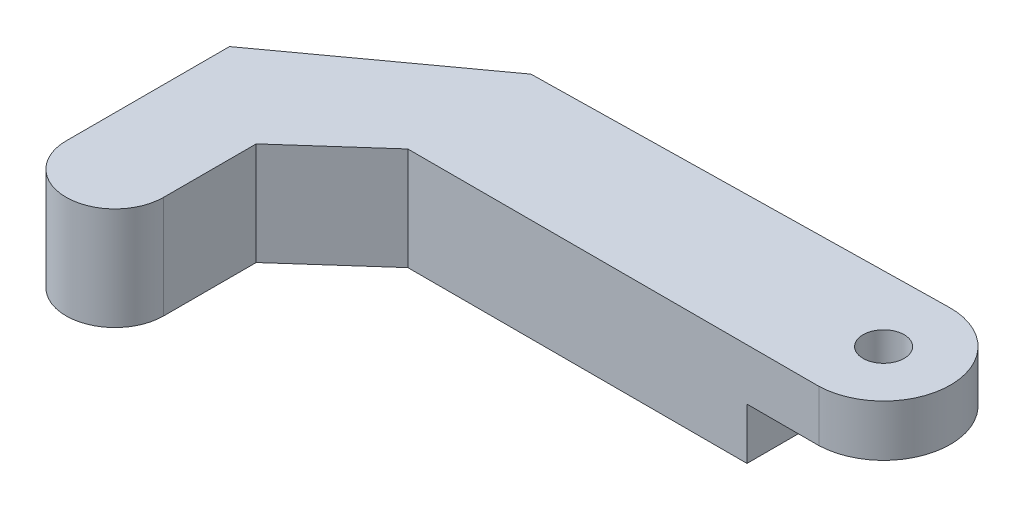
from build123d import *

# Parameters (mm, degrees)
CROQUIS1_R              = 2
SALIENTE_EXTRUIR1_DEPTH = 10
CROQUIS3_R              = 2
CORTAR_EXTRUIR1_DEPTH   = 5


with BuildPart() as part:
    # Croquis1 → Saliente-Extruir1 (new body)
    with BuildSketch(Plane(origin=(0, 0, 0), x_dir=(1, 0, 0), z_dir=(0, 1, 0))):
        with BuildLine():
            Line((0.204691251, -6.496776238), (-39.795308749, -6.496776238))
            Line((-39.795308749, -6.496776238), (-47.602797524, -13.442682877))
            Line((-47.602797524, -13.442682877), (-47.602797524, -22.442682877))
            ThreePointArc((-47.602797524, -22.442682877), (-52.352797524, -27.192682877), (-57.102797524, -22.442682877))
            Line((-57.102797524, -22.442682877), (-57.102797524, -6.542682877))
            Line((-57.102797524, -6.542682877), (-40.113440642, 5.800807421))
            Line((-40.113440642, 5.800807421), (-0.113440642, 6.499010019))
            ThreePointArc((-0.113440642, 6.499010019), (6.498053307, 0.159069868), (0.204691251, -6.496776238))
        make_face()
        with Locations(Location((0, 0, 0), (0, 0, 270))):
            Circle(CROQUIS1_R, mode=Mode.SUBTRACT)
    extrude(amount=SALIENTE_EXTRUIR1_DEPTH)

    # Croquis3 → Cortar-Extruir1 (cut)
    with BuildSketch(Plane.XZ):
        with BuildLine():
            Line((0.204691251, 6.496776238), (-6.795308749, 6.496776238))
            Line((-6.795308749, 6.496776238), (-6.795308749, -6.382377577))
            Line((-6.795308749, -6.382377577), (-0.113440642, -6.499010019))
            ThreePointArc((-0.113440642, -6.499010019), (6.498053307, -0.159069868), (0.204691251, 6.496776238))
        make_face()
        with Locations(Location((0, 0, 0), (0, 0, 270))):
            Circle(CROQUIS3_R, mode=Mode.SUBTRACT)
    extrude(amount=-CORTAR_EXTRUIR1_DEPTH, mode=Mode.SUBTRACT)


solid = part.part
